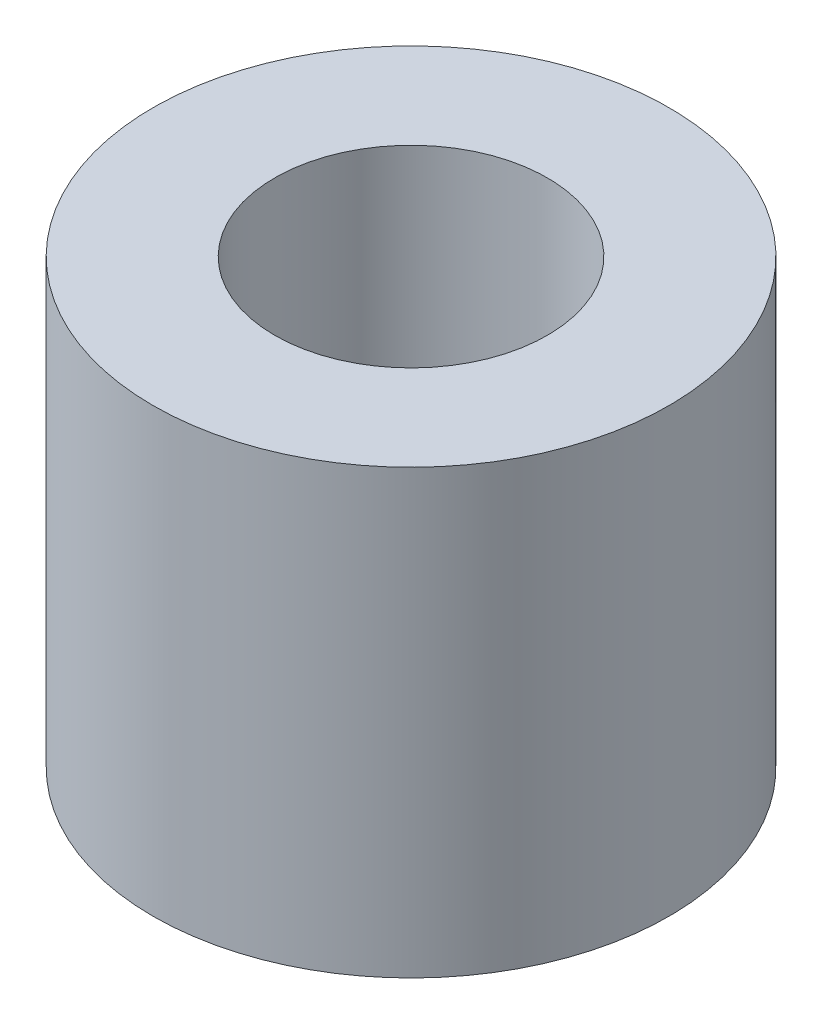
from build123d import *

# Parameters (mm, degrees)
SKETCH_1_R      = 3.5
SKETCH_1_R_2    = 1.85
EXTRUDE_1_DEPTH = 6


with BuildPart() as part:
    # 草图1 → 凸台-拉伸1 (new body)
    with BuildSketch(Plane(origin=(0, 0, 0), x_dir=(1, 0, 0), z_dir=(0, 1, 0))):
        with Locations(Location((0, 0, 0), (0, 0, 270))):
            Circle(SKETCH_1_R)
        with Locations(Location((0, 0, 0), (0, 0, 270))):
            Circle(SKETCH_1_R_2, mode=Mode.SUBTRACT)
    extrude(amount=EXTRUDE_1_DEPTH)


solid = part.part
